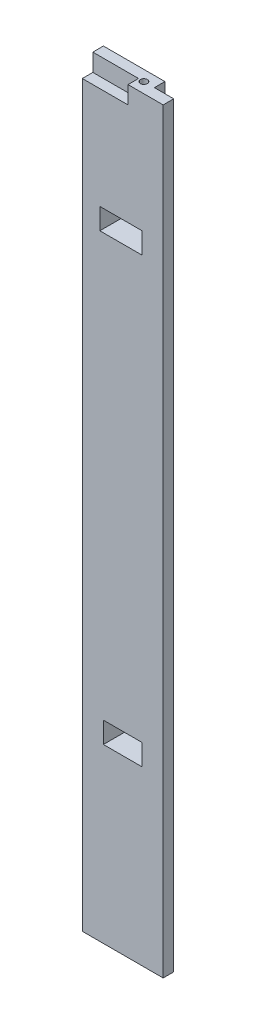
from build123d import *

# Parameters (mm, degrees)
BOSS_EXTRU_1_DEPTH           = 215
ESQUISSE2_W                  = 13
ESQUISSE2_H                  = 3
ENL_V_MAT_EXTRU_1_DEPTH      = 5
ESQUISSE3_W                  = 12
ESQUISSE3_H                  = 6
ENL_V_MAT_EXTRU_2_DEPTH      = 217.309962785
ESQUISSE4_R                  = 1
ENL_V_MAT_EXTRU_3_DEPTH      = 10
ENL_V_MAT_EXTRU_4_DEPTH      = 217.309962785
ENL_V_MAT_EXTRU_4_DEPTH_BACK = 217.309962785
ESQUISSE5_W                  = 11
ESQUISSE5_H                  = 6


with BuildPart() as part:
    # Esquisse1 → Boss.-Extru.1 (new body)
    with BuildSketch(Plane(origin=(0, 0, 0), x_dir=(1, 0, 0), z_dir=(0, 1, 0))):
        Polygon((0, 0), (0, 6), (17.5, 6), (17.5, 3), (23, 3), (23, 0), align=None)
    extrude(amount=BOSS_EXTRU_1_DEPTH)

    # Esquisse2 → Enlèv. mat.-Extru.1 (cut)
    with BuildSketch(Plane(origin=(0, 215, 0), x_dir=(1, 0, 0), z_dir=(0, 1, 0))):
        with Locations((6.5, 1.5)):
            Rectangle(ESQUISSE2_W, ESQUISSE2_H)
    extrude(amount=-ENL_V_MAT_EXTRU_1_DEPTH, mode=Mode.SUBTRACT)

    # Esquisse3 → Enlèv. mat.-Extru.2 (cut, through all)
    with BuildSketch(Plane.XY):
        with Locations((11, 178)):
            Rectangle(ESQUISSE3_W, ESQUISSE3_H)
    extrude(amount=-ENL_V_MAT_EXTRU_2_DEPTH, mode=Mode.SUBTRACT)

    # Esquisse4 → Enlèv. mat.-Extru.3 (cut)
    with BuildSketch(Plane(origin=(0, 215, 0), x_dir=(1, 0, 0), z_dir=(0, 1, 0))):
        with Locations(Location((14.5, 3, 0), (0, 0, 270))):
            Circle(ESQUISSE4_R)
    extrude(amount=-ENL_V_MAT_EXTRU_3_DEPTH, mode=Mode.SUBTRACT)

    # Esquisse5 → Enlèv. mat.-Extru.4 (cut, two sides: drawn at the far end of the back side and taken through both)
    with BuildSketch(Plane(origin=(0, 0, -6), x_dir=(-1, 0, 0), z_dir=(0, 0, -1)).offset(-ENL_V_MAT_EXTRU_4_DEPTH_BACK)):
        with Locations((-11.5, 52)):
            Rectangle(ESQUISSE5_W, ESQUISSE5_H)
    extrude(amount=ENL_V_MAT_EXTRU_4_DEPTH + ENL_V_MAT_EXTRU_4_DEPTH_BACK, mode=Mode.SUBTRACT)


solid = part.part
